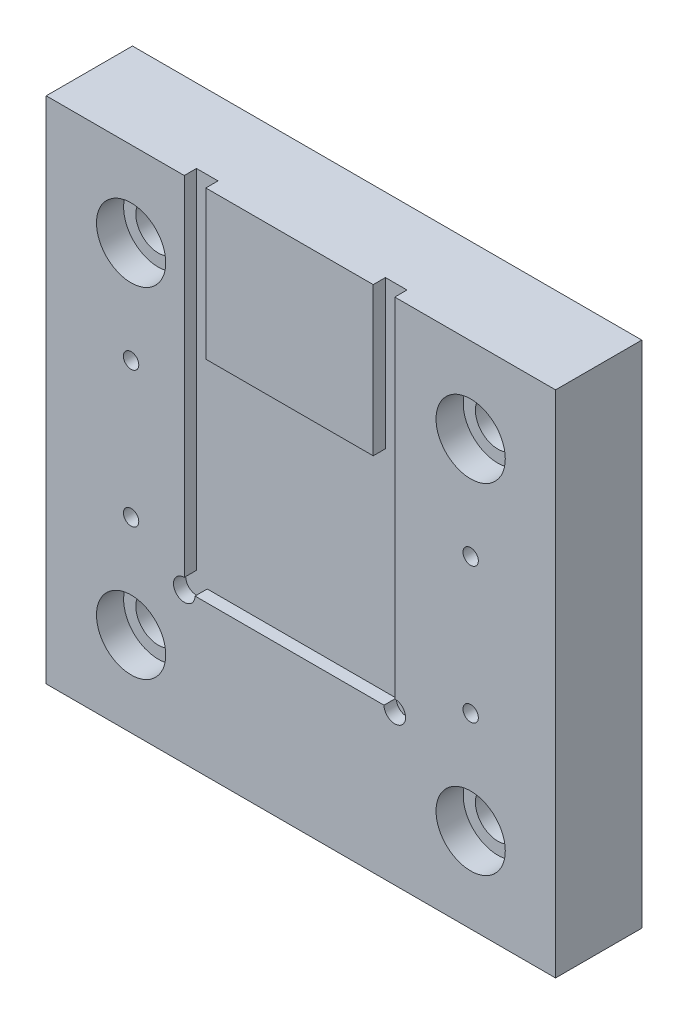
from build123d import *

# Parameters (mm, degrees)
SKETCH1_W           = 75
SKETCH1_H           = 75
SKETCH1_R           = 3.3
SKETCH1_R_2         = 1.1303
BOSS_EXTRUDE1_DEPTH = 12.7
SKETCH2_R           = 5.1
CUT_EXTRUDE1_DEPTH  = 4
CUT_EXTRUDE2_DEPTH  = 1.8


with BuildPart() as part:
    # Sketch1 → Boss-Extrude1 (new body)
    with BuildSketch(Plane.XY):
        with Locations((-35.66615728, 23.529473029)):
            Rectangle(SKETCH1_W, SKETCH1_H)
        with Locations((-60.66615728, -1.470526971)):
            Circle(SKETCH1_R, mode=Mode.SUBTRACT)
        with Locations((-10.66615728, -1.470526971)):
            Circle(SKETCH1_R, mode=Mode.SUBTRACT)
        with Locations((-10.66615728, 48.529473029)):
            Circle(SKETCH1_R, mode=Mode.SUBTRACT)
        with Locations((-60.66615728, 48.529473029)):
            Circle(SKETCH1_R, mode=Mode.SUBTRACT)
        with Locations((-60.66615728, 33.529473029)):
            Circle(SKETCH1_R_2, mode=Mode.SUBTRACT)
        with Locations((-10.66615728, 33.529473029)):
            Circle(SKETCH1_R_2, mode=Mode.SUBTRACT)
        with Locations((-60.66615728, 13.529473029)):
            Circle(SKETCH1_R_2, mode=Mode.SUBTRACT)
        with Locations((-10.66615728, 13.529473029)):
            Circle(SKETCH1_R_2, mode=Mode.SUBTRACT)
    extrude(amount=BOSS_EXTRUDE1_DEPTH)

    # Sketch2 → Cut-Extrude1 (cut)
    with BuildSketch(Plane.XY.offset(12.7)):
        with Locations((-60.66615728, 48.529473029)):
            Circle(SKETCH2_R)
        with Locations((-10.66615728, 48.529473029)):
            Circle(SKETCH2_R)
        with Locations((-60.66615728, -1.470526971)):
            Circle(SKETCH2_R)
        with Locations((-10.66615728, -1.470526971)):
            Circle(SKETCH2_R)
    extrude(amount=-CUT_EXTRUDE1_DEPTH, mode=Mode.SUBTRACT)

    # Sketch3 → Cut-Extrude2 (cut)
    with BuildSketch(Plane.XY.offset(12.7)):
        with BuildLine():
            Line((-49.663826945, 39.194037394), (-25.013826945, 39.194037394))
            Line((-25.013826945, 39.194037394), (-25.013826945, 61.029473029))
            Line((-25.013826945, 61.029473029), (-21.838826945, 61.029473029))
            Line((-21.838826945, 61.029473029), (-21.838826945, 39.194037394))
            Line((-21.838826945, 39.194037394), (-21.838826945, 9.781537394))
            ThreePointArc((-21.838826945, 9.781537394), (-20.71629493, 7.071505379), (-23.426326945, 8.194037394))
            Line((-23.426326945, 8.194037394), (-51.251326945, 8.194037394))
            ThreePointArc((-51.251326945, 8.194037394), (-53.96135896, 7.071505379), (-52.838826945, 9.781537394))
            Line((-52.838826945, 9.781537394), (-52.838826945, 39.194037394))
            Line((-52.838826945, 39.194037394), (-52.838826945, 61.029473029))
            Line((-52.838826945, 61.029473029), (-49.663826945, 61.029473029))
            Line((-49.663826945, 61.029473029), (-49.663826945, 39.194037394))
        make_face()
    extrude(amount=-CUT_EXTRUDE2_DEPTH, mode=Mode.SUBTRACT)


solid = part.part
